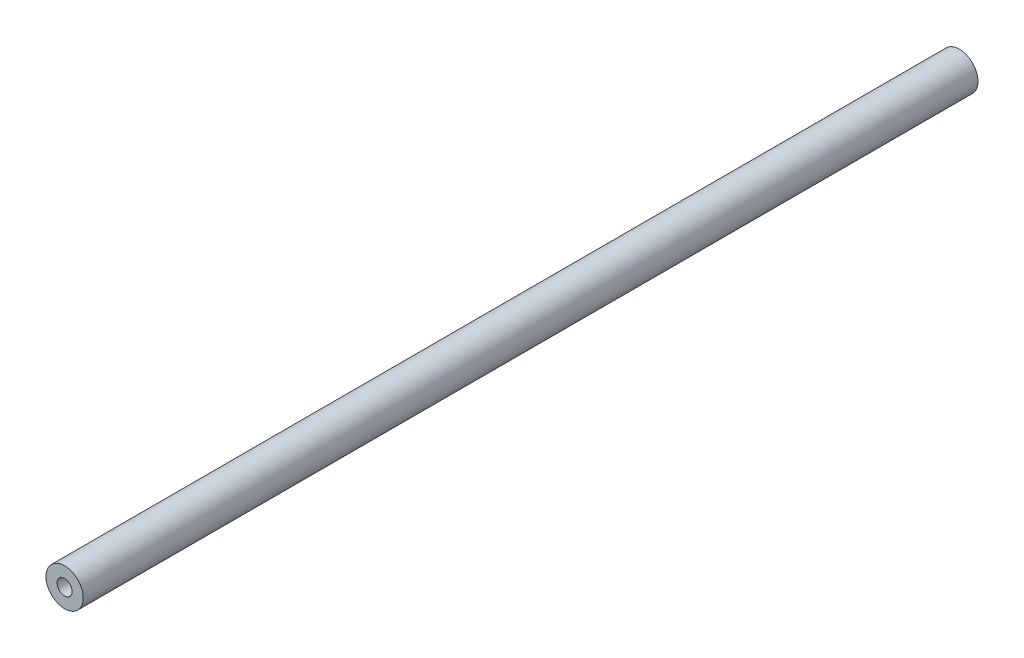
from build123d import *

# Parameters (mm, degrees)
BOSS_EXTRUDE1_DEPTH      = 152.4
BOSS_EXTRUDE1_DEPTH_BACK = 152.4
SKETCH3_R                = 6.35


with BuildPart() as part:
    # Sketch3 → Boss-Extrude1 (new, two sides: drawn at the far end of the back side and taken through both)
    with BuildSketch(Plane.XY.offset(-BOSS_EXTRUDE1_DEPTH_BACK)):
        Circle(SKETCH3_R)
    extrude(amount=BOSS_EXTRUDE1_DEPTH + BOSS_EXTRUDE1_DEPTH_BACK)

    # Sketch7 → 1/4-20 Tapped Hole1 (revolve, cut)
    with BuildSketch(Plane(origin=(0, 0, -152.4), x_dir=(0, 1, 0), z_dir=(1, 0, 0))):
        Polygon((0, 0), (0, 26.933816902), (2.5527, 25.4), (2.5527, 0), align=None)
    f_1_4_20_tapped_hole1 = revolve(axis=Axis((0, 0, -158.75), (0, 0, 1)), mode=Mode.SUBTRACT)

    # Mirror1: 1/4-20 Tapped Hole1 across plane
    add(f_1_4_20_tapped_hole1.mirror(Plane.XY), mode=Mode.SUBTRACT)


solid = part.part
